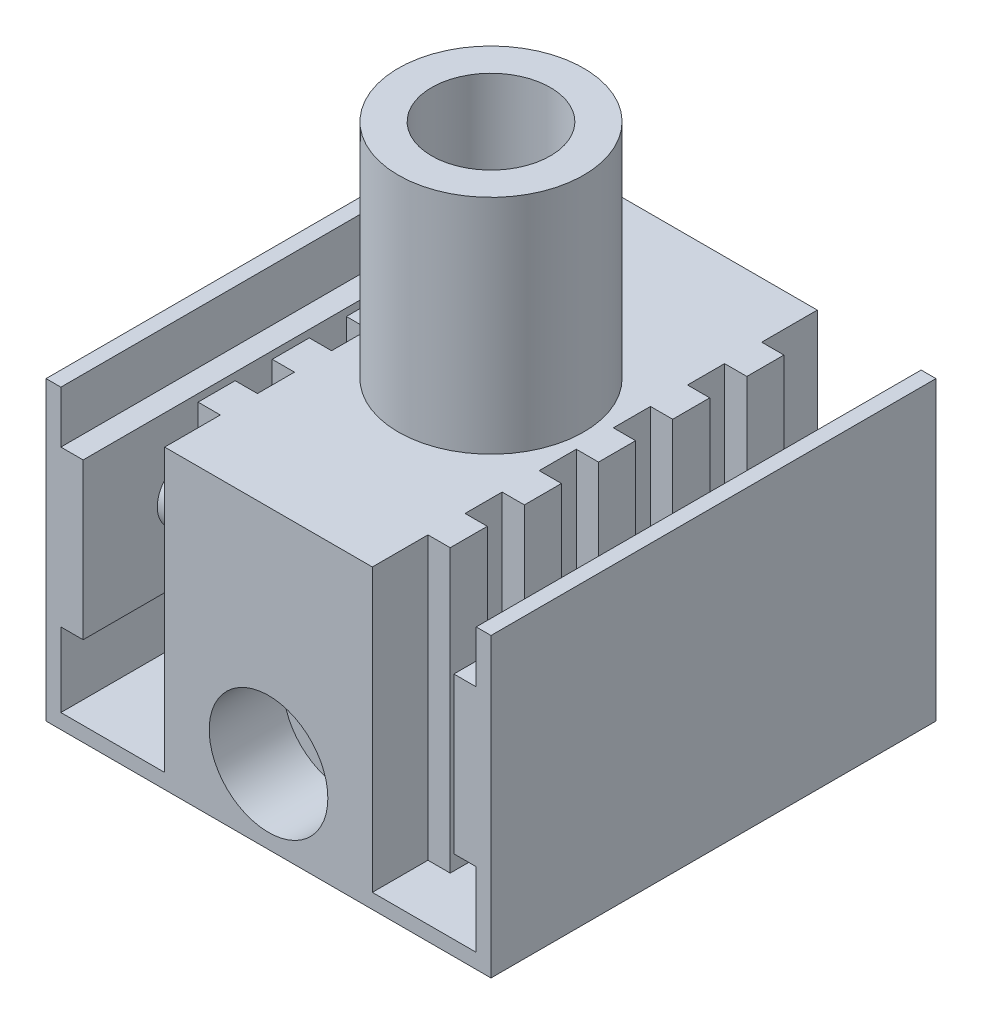
from build123d import *

# Parameters (mm, degrees)
ESBO_O1_R                = 12.5
RESSALTO_EXTRUS_O1_DEPTH = 30
ESBO_O2_R                = 8
CORTE_EXTRUS_O1_DEPTH    = 15
ESBO_O3_W                = 3
ESBO_O3_H                = 5
CORTE_EXTRUS_O2_DEPTH    = 6.5
ESBO_O4_W                = 60
ESBO_O4_H                = 60
RESSALTO_EXTRUS_O2_DEPTH = 40
ESBO_O5_W                = 11
ESBO_O5_H                = 60
CORTE_EXTRUS_O3_DEPTH    = 35
ESBO_O6_W                = 11
ESBO_O6_H                = 60
CORTE_EXTRUS_O4_DEPTH    = 38
ESBO_O7_W                = 60
ESBO_O7_H                = 21
RESSALTO_EXTRUS_O3_DEPTH = 3.00002654
ESBO_O8_W                = 60
ESBO_O8_H                = 21
RESSALTO_EXTRUS_O4_DEPTH = 3.004451555
RESSALTO_EXTRUS_O5_DEPTH = 2.995218695
RESSALTO_EXTRUS_O6_START = 3
RESSALTO_EXTRUS_O6_DEPTH = 3
ESBO_O15_R               = 8
CORTE_EXTRUS_O5_DEPTH    = 70.462219947
ESBO_O19_W               = 5
ESBO_O19_H               = 38
ESBO_O19_W_2             = 7.5
CORTE_EXTRUS_O7_DEPTH    = 3
ESBO_O20_W               = 7.5
ESBO_O20_H               = 38
ESBO_O20_W_2             = 5
CORTE_EXTRUS_O8_DEPTH    = 3
ESBO_O21_R               = 8
CORTE_EXTRUS_O9_DEPTH    = 10
CORTE_EXTRUS_O10_START   = -10
ESBO_O22_R               = 8
CORTE_EXTRUS_O10_DEPTH   = 10
ESBO_O24_R               = 5
CORTE_EXTRUS_O11_DEPTH   = 71.710678119


with BuildPart() as part:
    # Esboço1 → Ressalto-extrusão1 (new body)
    with BuildSketch(Plane(origin=(0, 0, 0), x_dir=(1, 0, 0), z_dir=(0, 1, 0))):
        with Locations(Location((0, 0, 0), (0, 0, 270))):
            Circle(ESBO_O1_R)
    extrude(amount=RESSALTO_EXTRUS_O1_DEPTH)

    # Esboço2 → Corte-extrusão1 (cut)
    with BuildSketch(Plane(origin=(0, 30, 0), x_dir=(1, 0, 0), z_dir=(0, 1, 0))):
        with Locations(Location((0, 0, 0), (0, 0, 270))):
            Circle(ESBO_O2_R)
    extrude(amount=-CORTE_EXTRUS_O1_DEPTH, mode=Mode.SUBTRACT)

    # Esboço3 → Corte-extrusão2 (cut)
    with BuildSketch(Plane.XZ):
        Rectangle(ESBO_O3_W, ESBO_O3_H)
    extrude(amount=-CORTE_EXTRUS_O2_DEPTH, mode=Mode.SUBTRACT)

    # Esboço4 → Ressalto-extrusão2 (add)
    with BuildSketch(Plane.XZ):
        Rectangle(ESBO_O4_W, ESBO_O4_H)
    extrude(amount=RESSALTO_EXTRUS_O2_DEPTH)

    # Esboço5 → Corte-extrusão3 (cut)
    with BuildSketch(Plane(origin=(0, 0, 0), x_dir=(1, 0, 0), z_dir=(0, 1, 0))):
        with Locations((-22.5, 0)):
            Rectangle(ESBO_O5_W, ESBO_O5_H)
        with Locations((22.5, 0)):
            Rectangle(ESBO_O5_W, ESBO_O5_H)
    extrude(amount=-CORTE_EXTRUS_O3_DEPTH, mode=Mode.SUBTRACT)

    # Esboço6 → Corte-extrusão4 (cut)
    with BuildSketch(Plane(origin=(0, 0, 0), x_dir=(1, 0, 0), z_dir=(0, 1, 0))):
        with Locations((-22.5, 0)):
            Rectangle(ESBO_O6_W, ESBO_O6_H)
        with Locations((22.5, 0)):
            Rectangle(ESBO_O6_W, ESBO_O6_H)
    extrude(amount=-CORTE_EXTRUS_O4_DEPTH, mode=Mode.SUBTRACT)

    # Esboço7 → Ressalto-extrusão3 (add)
    with BuildSketch(Plane(origin=(-28, 0, 0), x_dir=(0, 0, -1), z_dir=(1, 0, 0))):
        with Locations((0, -17.5)):
            Rectangle(ESBO_O7_W, ESBO_O7_H)
    extrude(amount=RESSALTO_EXTRUS_O3_DEPTH)

    # Esboço8 → Ressalto-extrusão4 (add)
    with BuildSketch(Plane.ZY.offset(-28)):
        with Locations((0, -17.5)):
            Rectangle(ESBO_O8_W, ESBO_O8_H)
    extrude(amount=RESSALTO_EXTRUS_O4_DEPTH)

    # Esboço9 → Ressalto-extrusão5 (add)
    with BuildSketch(Plane.ZY.offset(-24.995548445)):
        with BuildLine():
            Line((-16, -13.5), (16, -13.5))
            ThreePointArc((16, -13.5), (20, -17.5), (16, -21.5))
            Line((16, -21.5), (-16, -21.5))
            ThreePointArc((-16, -21.5), (-20, -17.5), (-16, -13.5))
        make_face()
    extrude(amount=RESSALTO_EXTRUS_O5_DEPTH)

    # Esboço14 → Ressalto-extrusão6 (add)
    with BuildSketch(Plane(origin=(-24.99997346, 0, 0), x_dir=(0, 0, -1), z_dir=(1, 0, 0)).offset(RESSALTO_EXTRUS_O6_START)):
        with BuildLine():
            Line((-16, -13.5), (16, -13.5))
            ThreePointArc((16, -13.5), (20, -17.5), (16, -21.5))
            Line((16, -21.5), (-16, -21.5))
            ThreePointArc((-16, -21.5), (-20, -17.5), (-16, -13.5))
        make_face()
    extrude(amount=-RESSALTO_EXTRUS_O6_DEPTH)

    # Esboço15 → Corte-extrusão5 (cut, through all)
    with BuildSketch(Plane(origin=(0, 15, 0), x_dir=(1, 0, 0), z_dir=(0, 1, 0))):
        with Locations(Location((0, 0, 0), (0, 0, 270))):
            Circle(ESBO_O15_R)
    extrude(amount=-CORTE_EXTRUS_O5_DEPTH, mode=Mode.SUBTRACT)

    # Esboço19 → Corte-extrusão7 (cut)
    with BuildSketch(Plane.ZY.offset(17)):
        with Locations((-15, -19)):
            Rectangle(ESBO_O19_W, ESBO_O19_H)
        with Locations((-26.25, -19)):
            Rectangle(ESBO_O19_W_2, ESBO_O19_H)
        with Locations((-5, -19)):
            Rectangle(ESBO_O19_W, ESBO_O19_H)
        with Locations((5, -19)):
            Rectangle(ESBO_O19_W, ESBO_O19_H)
        with Locations((15, -19)):
            Rectangle(ESBO_O19_W, ESBO_O19_H)
        with Locations((26.25, -19)):
            Rectangle(ESBO_O19_W_2, ESBO_O19_H)
    extrude(amount=-CORTE_EXTRUS_O7_DEPTH, mode=Mode.SUBTRACT)

    # Esboço20 → Corte-extrusão8 (cut)
    with BuildSketch(Plane(origin=(17, 0, 0), x_dir=(0, 0, -1), z_dir=(1, 0, 0))):
        with Locations((-26.25, -19)):
            Rectangle(ESBO_O20_W, ESBO_O20_H)
        with Locations((-15, -19)):
            Rectangle(ESBO_O20_W_2, ESBO_O20_H)
        with Locations((-5, -19)):
            Rectangle(ESBO_O20_W_2, ESBO_O20_H)
        with Locations((5, -19)):
            Rectangle(ESBO_O20_W_2, ESBO_O20_H)
        with Locations((15, -19)):
            Rectangle(ESBO_O20_W_2, ESBO_O20_H)
        with Locations((26.25, -19)):
            Rectangle(ESBO_O20_W, ESBO_O20_H)
    extrude(amount=-CORTE_EXTRUS_O8_DEPTH, mode=Mode.SUBTRACT)

    # Esboço21 → Corte-extrusão9 (cut)
    with BuildSketch(Plane.XY.offset(30)):
        with Locations((0, -30)):
            Circle(ESBO_O21_R)
    extrude(amount=-CORTE_EXTRUS_O9_DEPTH, mode=Mode.SUBTRACT)

    # Esboço22 → Corte-extrusão10 (cut)
    with BuildSketch(Plane(origin=(0, 0, -30), x_dir=(-1, 0, 0), z_dir=(0, 0, -1)).offset(CORTE_EXTRUS_O10_START)):
        with Locations(Location((0, -30, 0), (0, 0, 180))):
            Circle(ESBO_O22_R)
    extrude(amount=CORTE_EXTRUS_O10_DEPTH, mode=Mode.SUBTRACT)

    # Esboço24 → Corte-extrusão11 (cut, through all)
    with BuildSketch(Plane(origin=(0, 0, -20), x_dir=(-1, 0, 0), z_dir=(0, 0, -1))):
        with Locations(Location((0, -30, 0), (0, 0, 270))):
            Circle(ESBO_O24_R)
    extrude(amount=-CORTE_EXTRUS_O11_DEPTH, mode=Mode.SUBTRACT)


solid = part.part
